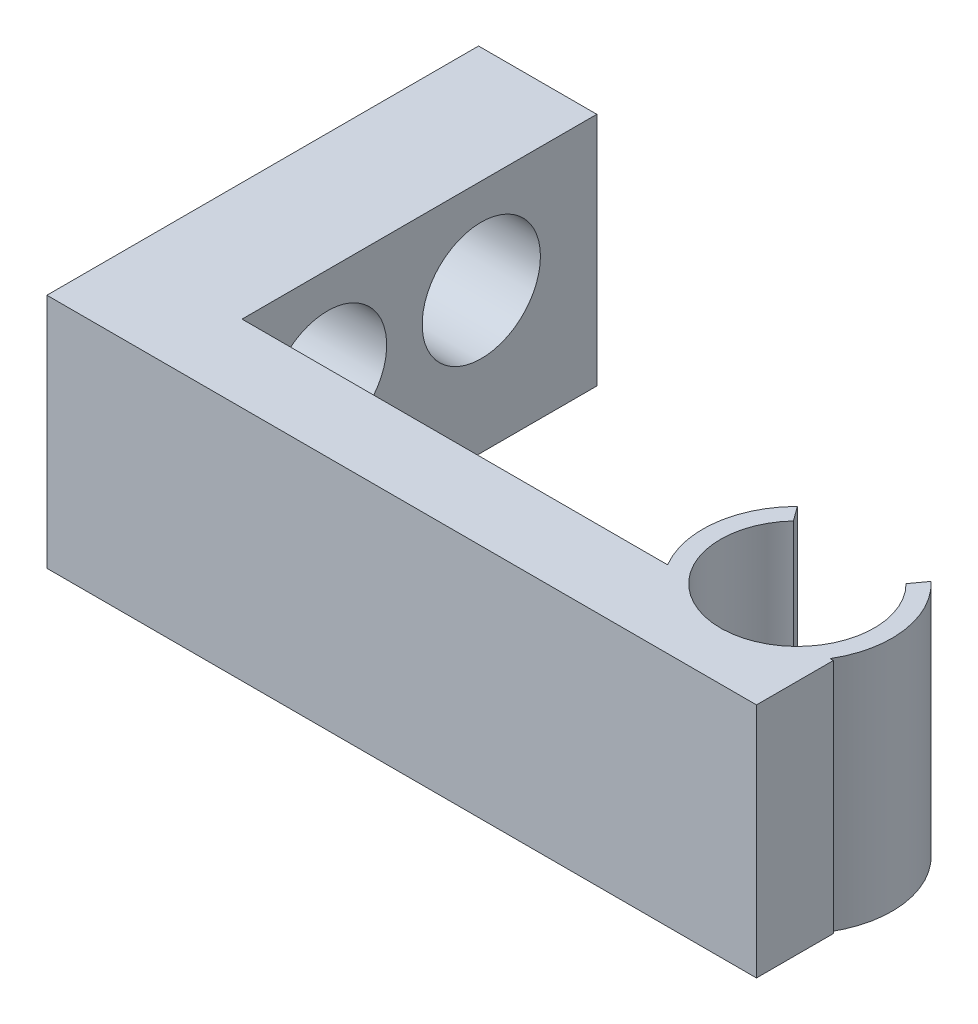
from build123d import *

# Parameters (mm, degrees)
EXTRUDE_1_DEPTH     = 20
SKETCH_2_W          = 10
SKETCH_2_H          = 19.900109324
EXTRUDE_2_DEPTH     = 30
SKETCH_3_R          = 2.5
CUT_EXTRUDE_1_DEPTH = 15
SKETCH_6_R          = 5
CUT_EXTRUDE_3_DEPTH = 9


with BuildPart() as part:
    # 草圖1 → 填料-伸長1 (new body)
    with BuildSketch(Plane(origin=(0, 0, 0), x_dir=(1, 0, 0), z_dir=(0, 1, 0))):
        with BuildLine():
            Line((18.090545138, 11.779886892), (17.195277264, 13.012117407))
            ThreePointArc((17.195277264, 13.012117407), (14.912835639, 8.338920118), (15.985777721, 3.25))
            Line((15.985777721, 3.25), (-30, 3.25))
            Line((-30, 3.25), (-30, -3.25))
            Line((-30, -3.25), (30, -3.25))
            Line((30, -3.25), (30, 3.25))
            Line((30, 3.25), (29.718485306, 3.25))
            ThreePointArc((29.718485306, 3.25), (30.775982744, 8.456436022), (28.338903699, 13.177232841))
            Line((28.338903699, 13.177232841), (27.448325592, 11.951457236))
            ThreePointArc((27.448325592, 11.951457236), (22.97128582, 0.856355384), (18.090545138, 11.779886892))
        make_face()
    extrude(amount=EXTRUDE_1_DEPTH)

    # 草圖2 → 填料-伸長2 (add)
    with BuildSketch(Plane(origin=(0, 0, -3.25), x_dir=(-1, 0, 0), z_dir=(0, 0, -1))):
        with Locations((25, 10.049945338)):
            Rectangle(SKETCH_2_W, SKETCH_2_H)
    extrude(amount=EXTRUDE_2_DEPTH)

    # 草圖3 → 除料-伸長1 (cut)
    with BuildSketch(Plane(origin=(-20, 0, 0), x_dir=(0, 0, -1), z_dir=(1, 0, 0))):
        with Locations((23.481727135, 11.991404281)):
            Circle(SKETCH_3_R)
        with Locations(Location((10.481727135, 11.991404281, 0), (0, 0, 180))):
            Circle(SKETCH_3_R)
    extrude(amount=-CUT_EXTRUDE_1_DEPTH, mode=Mode.SUBTRACT)

    # 草圖6 → 除料-伸長3 (cut)
    with BuildSketch(Plane(origin=(-20, 0, 0), x_dir=(0, 0, -1), z_dir=(1, 0, 0))):
        with Locations((23.481727135, 11.991404281)):
            Circle(SKETCH_6_R)
        with Locations(Location((10.481727135, 11.991404281, 0), (0, 0, 180))):
            Circle(SKETCH_6_R)
    extrude(amount=-CUT_EXTRUDE_3_DEPTH, mode=Mode.SUBTRACT)


solid = part.part
